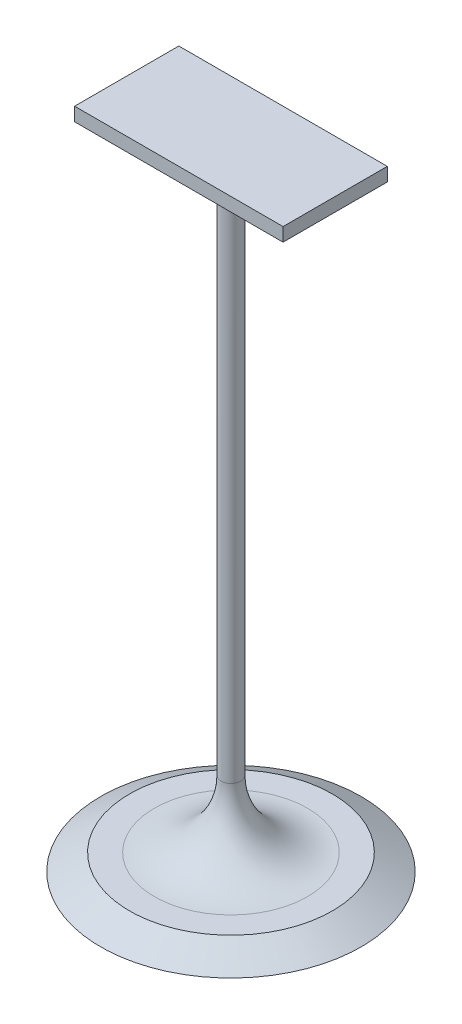
from build123d import *

# Parameters (mm, degrees)
RACCORDO2_R                  = 6.4
SCHIZZO5_W                   = 20
SCHIZZO5_H                   = 10
ESTRUSIONE_ESTRUSIONE1_DEPTH = 1.3


with BuildPart() as part:
    # Schizzo4 → Rivoluzione9 (revolve)
    with BuildSketch(Plane.XY, mode=Mode.PRIVATE) as rivoluzione9_sk:
        Polygon((0, 0), (-12.5, 0), (-9.728718708, 1.6), (-0.95, 1.6), (-0.95, 8), (-0.95, 59.8), (0, 59.8), align=None)
    revolve(rivoluzione9_sk.sketch.rotate(Axis((0, -7.357121252, 0), (0, 1, 0)), 270), axis=Axis((0, -7.357121252, 0), (0, 1, 0)))

    # Raccordo2
    raccordo2_edges = [part.edges().sort_by_distance(p)[0] for p in [
        (0, 1.6, 0.95),
    ]]
    fillet(raccordo2_edges, radius=RACCORDO2_R)

    # Schizzo5 → Estrusione-Estrusione1 (add)
    with BuildSketch(Plane(origin=(0, 59.8, 0), x_dir=(1, 0, 0), z_dir=(0, 1, 0))):
        Rectangle(SCHIZZO5_W, SCHIZZO5_H)
    extrude(amount=ESTRUSIONE_ESTRUSIONE1_DEPTH)


solid = part.part
